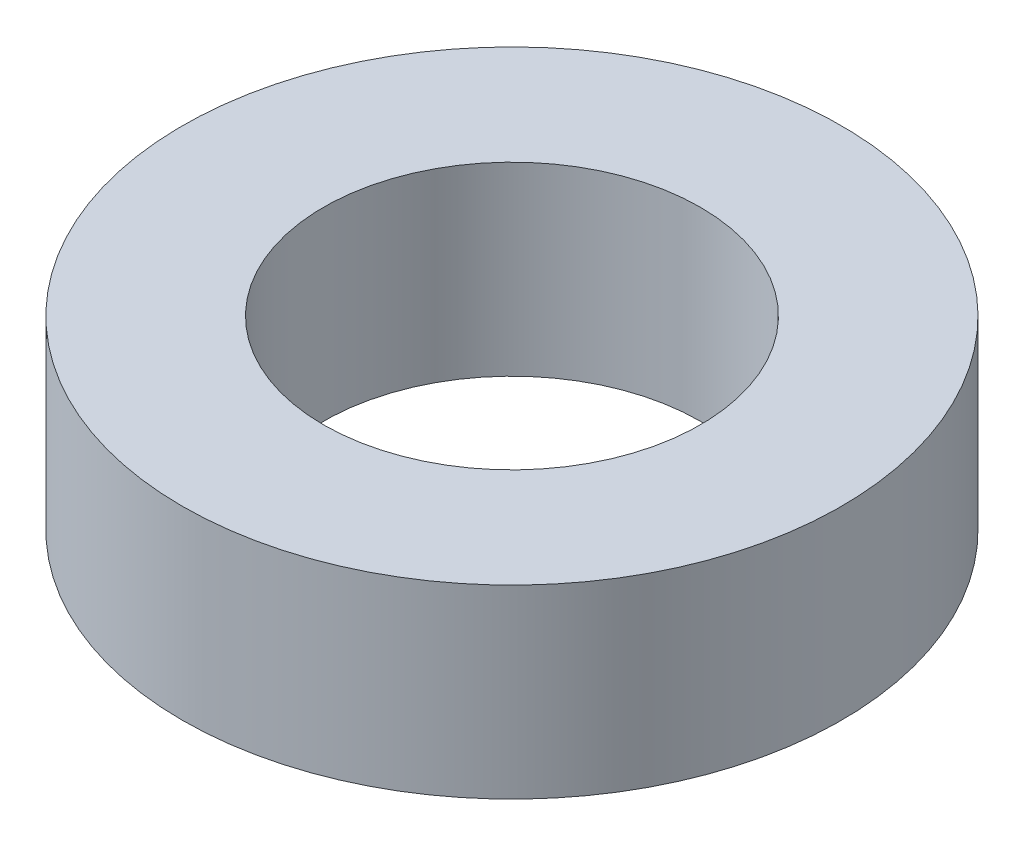
from build123d import *

# Parameters (mm, degrees)
SKETCH1_R           = 5.334
SKETCH1_R_2         = 3.05
BOSS_EXTRUDE1_DEPTH = 3


with BuildPart() as part:
    # Sketch1 → Boss-Extrude1 (new body)
    with BuildSketch(Plane(origin=(0, 0, 0), x_dir=(1, 0, 0), z_dir=(0, 1, 0))):
        with Locations(Location((0, 0, 0), (0, 0, 270))):
            Circle(SKETCH1_R)
        with Locations(Location((0, 0, 0), (0, 0, 270))):
            Circle(SKETCH1_R_2, mode=Mode.SUBTRACT)
    extrude(amount=BOSS_EXTRUDE1_DEPTH)


solid = part.part
